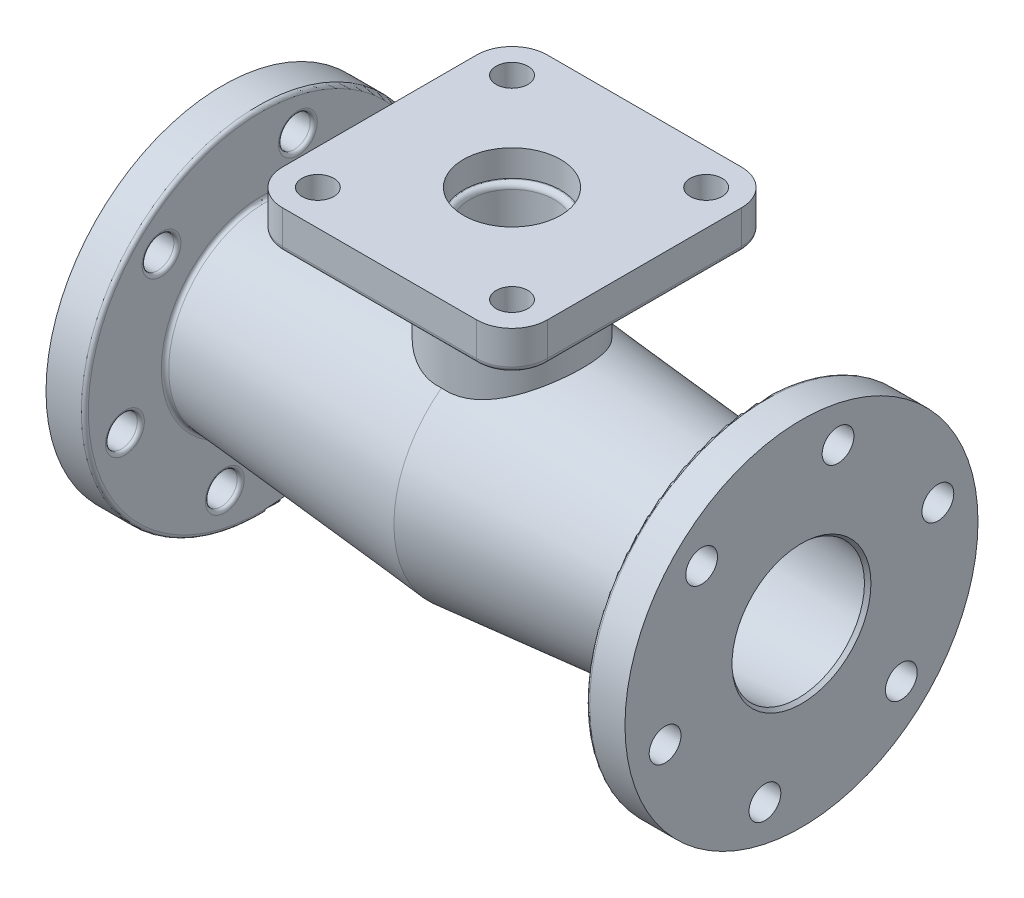
from build123d import *
from OCP.BRepFilletAPI import BRepFilletAPI_MakeChamfer

# Parameters (mm, degrees)
F_5_0MM_DOWEL_HOLE1_D     = 18
F_5_0MM_DOWEL_HOLE1_DEPTH = 22
CIRPATTERN1_COUNT         = 6
MIRROR1_COPY_1_D          = 18
MIRROR1_COPY_1_DEPTH      = 22
MIRROR1_COPY_2_D          = 18
MIRROR1_COPY_2_DEPTH      = 22
MIRROR1_COPY_3_D          = 18
MIRROR1_COPY_3_DEPTH      = 22
MIRROR1_COPY_4_D          = 18
MIRROR1_COPY_4_DEPTH      = 22
MIRROR1_COPY_5_D          = 18
MIRROR1_COPY_5_DEPTH      = 22
SKETCH7_R                 = 40
SKETCH7_R_2               = 9
BOSS_EXTRUDE1_DEPTH       = 22
BOSS_EXTRUDE2_REACH       = 303.198
SKETCH7_2_R               = 40
FILLET1_R                 = 3
FILLET2_R                 = 3
FILLET3_R                 = 2
CHAMFER1_SIZE             = 2
CHAMFER1_SIZE2            = 1.846124693


with BuildPart() as part:
    # Sketch1 → Revolve1 (revolve)
    with BuildSketch(Plane.XY, mode=Mode.PRIVATE) as revolve1_sk:
        Polygon((-164, -37.5), (-164, -100), (-142, -100), (-142, -54.482048161), (0, -66.905438381), (142, -54.482048161), (142, -100), (164, -100), (164, -37.5), (0, -51.848140818), align=None)
    revolve(revolve1_sk.sketch.rotate(Axis((0, 0, 0), (1, 0, 0)), 270), axis=Axis((0, 0, 0), (1, 0, 0)))

    # Ø5.0mm Dowel Hole1
    with Locations(Plane(origin=(164, 0, 0), x_dir=(0, 0, -1), z_dir=(1, 0, 0))):
        with Locations((-77.274066103, -20.705523608)):
            f_5_0mm_dowel_hole1 = Hole(F_5_0MM_DOWEL_HOLE1_D / 2, depth=F_5_0MM_DOWEL_HOLE1_DEPTH)

    # CirPattern1: Ø5.0mm Dowel Hole1 ×6 about axis
    cirpattern1_axis = Axis((0, 0, 0), (1, 0, 0))
    for i in range(1, CIRPATTERN1_COUNT):
        add(f_5_0mm_dowel_hole1.rotate(cirpattern1_axis, i * 360 / CIRPATTERN1_COUNT), mode=Mode.SUBTRACT)

    # Mirror1: Ø5.0mm Dowel Hole1 across plane
    add(f_5_0mm_dowel_hole1.mirror(Plane(origin=(0, 0, 0), x_dir=(0, 0, 1), z_dir=(1, 0, 0))), mode=Mode.SUBTRACT)

    # Mirror1 copy 1
    with Locations(Plane(origin=(-164, 0, 0), x_dir=(0, 0.8660254037844386, -0.5000000000000001), z_dir=(-1, 0, 0))):
        with Locations((-77.274066103, 20.705523608)):
            Hole(MIRROR1_COPY_1_D / 2, depth=MIRROR1_COPY_1_DEPTH)

    # Mirror1 copy 2
    with Locations(Plane(origin=(-164, 0, 0), x_dir=(0, 0.8660254037844387, 0.4999999999999998), z_dir=(-1, 0, 0))):
        with Locations((-77.274066103, 20.705523608)):
            Hole(MIRROR1_COPY_2_D / 2, depth=MIRROR1_COPY_2_DEPTH)

    # Mirror1 copy 3
    with Locations(Plane.ZY.offset(164)):
        with Locations((-77.274066103, 20.705523608)):
            Hole(MIRROR1_COPY_3_D / 2, depth=MIRROR1_COPY_3_DEPTH)

    # Mirror1 copy 4
    with Locations(Plane(origin=(-164, 0, 0), x_dir=(0, -0.8660254037844384, 0.5000000000000004), z_dir=(-1, 0, 0))):
        with Locations((-77.274066103, 20.705523608)):
            Hole(MIRROR1_COPY_4_D / 2, depth=MIRROR1_COPY_4_DEPTH)

    # Mirror1 copy 5
    with Locations(Plane(origin=(-164, 0, 0), x_dir=(0, -0.8660254037844386, -0.5000000000000001), z_dir=(-1, 0, 0))):
        with Locations((-77.274066103, 20.705523608)):
            Hole(MIRROR1_COPY_5_D / 2, depth=MIRROR1_COPY_5_DEPTH)

    # Sketch7<2> → Boss-Extrude2 (add, up to next)
    with BuildSketch(Plane(origin=(0, 132, 0), x_dir=(1, 0, 0), z_dir=(0, 1, 0)), mode=Mode.PRIVATE) as boss_extrude2_sk1:
        with Locations(Location((0, 0, 0), (0, 0, 270))):
            Circle(SKETCH7_2_R)
    boss_extrude2_tool1 = extrude(boss_extrude2_sk1.sketch, amount=-BOSS_EXTRUDE2_REACH, mode=Mode.PRIVATE) - part.part


with BuildPart() as body_2:
    # Sketch7 → Boss-Extrude1 (new body)
    with BuildSketch(Plane(origin=(0, 132, 0), x_dir=(1, 0, 0), z_dir=(0, 1, 0))):
        with BuildLine():
            Line((-55, -75), (55, -75))
            ThreePointArc((55, -75), (69.142135624, -69.142135624), (75, -55))
            Line((75, -55), (75, 55))
            ThreePointArc((75, 55), (69.142135624, 69.142135624), (55, 75))
            Line((55, 75), (-55, 75))
            ThreePointArc((-55, 75), (-69.142135624, 69.142135624), (-75, 55))
            Line((-75, 55), (-75, -55))
            ThreePointArc((-75, -55), (-69.142135624, -69.142135624), (-55, -75))
        make_face()
        with Locations(Location((0, 0, 0), (0, 0, 270))):
            Circle(SKETCH7_R, mode=Mode.SUBTRACT)
        with Locations(Location((-55, 55, 0), (0, 0, 270))):
            Circle(SKETCH7_R_2, mode=Mode.SUBTRACT)
        with Locations(Location((55, 55, 0), (0, 0, 270))):
            Circle(SKETCH7_R_2, mode=Mode.SUBTRACT)
        with Locations(Location((55, -55, 0), (0, 0, 270))):
            Circle(SKETCH7_R_2, mode=Mode.SUBTRACT)
        with Locations(Location((-55, -55, 0), (0, 0, 270))):
            Circle(SKETCH7_R_2, mode=Mode.SUBTRACT)
    extrude(amount=-BOSS_EXTRUDE1_DEPTH)


with BuildPart() as part_1:
    add(part.part)

    add(body_2.part)  # Boss-Extrude2 merges body 2
    add(boss_extrude2_tool1.solids().sort_by_distance((0, 132, 0))[0])

    # Sketch8 → Cut-Revolve1 (revolve, cut)
    with BuildSketch(Plane.XY):
        Polygon((0, 132), (27.5, 132), (27.5, 117), (24, 117), (21.957757403, 0), (0, 0), align=None)
    revolve(axis=Axis((0, 0, 0), (0, 1, 0)), mode=Mode.SUBTRACT)

    # Fillet1
    fillet1_edges = [part_1.edges().sort_by_distance(p)[0] for p in [
        (-24, 117, 0),
    ]]
    fillet(fillet1_edges, radius=FILLET1_R)

    # Fillet2
    fillet2_edges = [part_1.edges().sort_by_distance(p)[0] for p in [
        (69.142135624, 110, 69.142135624),
        (0, 110, 75),
        (-69.142135624, 110, 69.142135624),
        (-75, 110, 0),
        (-69.142135624, 110, -69.142135624),
        (0, 110, -75),
        (69.142135624, 110, -69.142135624),
        (75, 110, 0),
    ]]
    fillet(fillet2_edges, radius=FILLET2_R)

    # Fillet3
    fillet3_edges = [part_1.edges().sort_by_distance(p)[0] for p in [
        (142, 0, -54.482048161),
        (-142, -69.479837469, 16.205523608),
        (142, 0, -100),
        (142, -20.705523608, 68.274066103),
        (142, 48.774313861, 52.068542495),
        (142, 69.479837469, -16.205523608),
        (142, 20.705523608, -68.274066103),
        (142, -48.774313861, -52.068542495),
        (142, -69.479837469, 16.205523608),
        (-142, -20.705523608, 68.274066103),
        (-142, 48.774313861, 52.068542495),
        (-142, 69.479837469, -16.205523608),
        (-142, 0, -100),
        (-142, 20.705523608, -68.274066103),
        (-142, 0, -54.482048161),
        (-142, -48.774313861, -52.068542495),
    ]]
    fillet(fillet3_edges, radius=FILLET3_R)

    # Chamfer1: one chamfer whose edges measure the first distance from different faces: ONE call of the kernel's chamfer builder (chamfer() names one face for all edges)
    chamfer1_edges_1 = [part_1.edges().sort_by_distance(p)[0] for p in [
        (164, 0, -37.5),
    ]]
    chamfer1_side_1 = [part_1.faces().sort_by_distance(p)[0] for p in [
        (82, 0, -44.674070409),
    ]]
    chamfer1_edges_2 = [part_1.edges().sort_by_distance(p)[0] for p in [
        (-164, 0, -37.5),
    ]]
    chamfer1_side_2 = [part_1.faces().sort_by_distance(p)[0] for p in [
        (-164, 0, -97.171572875),
    ]]
    chamfer1 = BRepFilletAPI_MakeChamfer(part_1.part.solid().wrapped)
    for e in chamfer1_edges_1:
        chamfer1.Add(CHAMFER1_SIZE, CHAMFER1_SIZE2, e.wrapped, chamfer1_side_1[0].wrapped)  # the first distance lies on this face
    for e in chamfer1_edges_2:
        chamfer1.Add(CHAMFER1_SIZE, CHAMFER1_SIZE2, e.wrapped, chamfer1_side_2[0].wrapped)  # the first distance lies on this face
    add(Compound.cast(chamfer1.Shape()), mode=Mode.REPLACE)


solid = part_1.part
